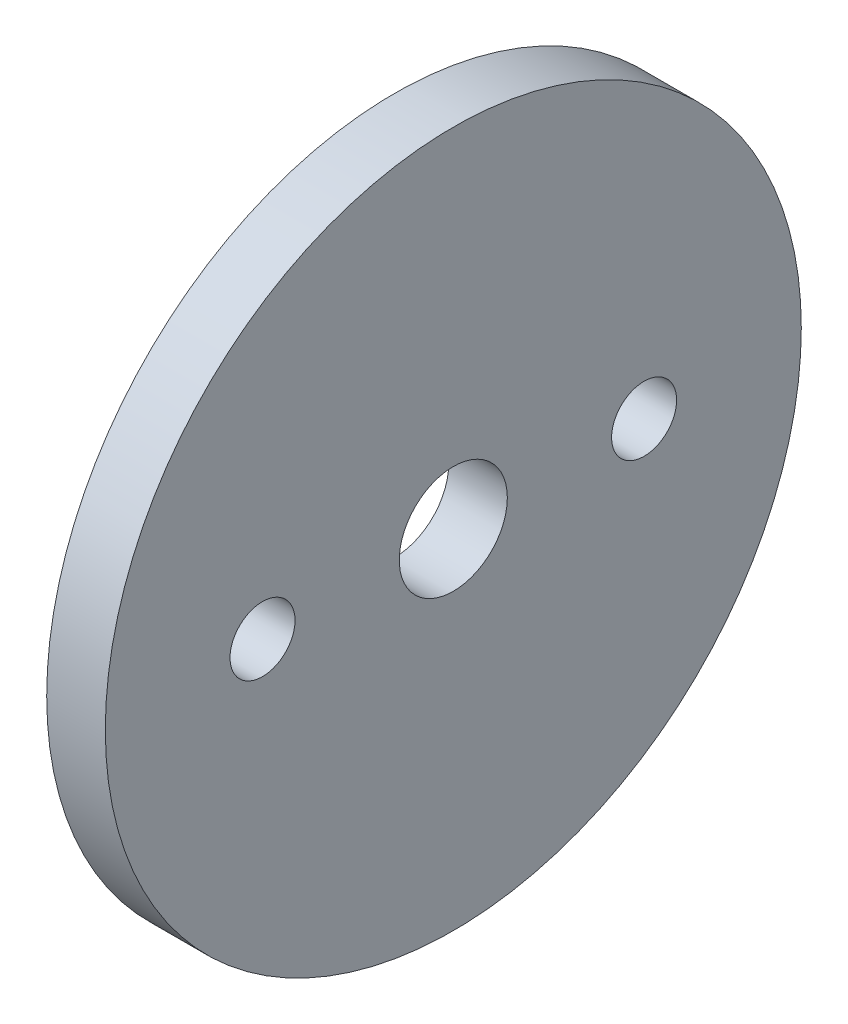
from build123d import *

# Parameters (mm, degrees)
SKETCH1_R                     = 14.478
BOSS_EXTRUDE1_DEPTH           = 2.4384
F_8_THREADED_ROD_CLEARANCE_D  = 4.4958
EJECTION_CHARGE_PASSTHROUGH_D = 2.7051


with BuildPart() as part:
    # Sketch1 → Boss-Extrude1 (new body)
    with BuildSketch(Plane(origin=(0, 0, 0), x_dir=(0, 0, -1), z_dir=(1, 0, 0))):
        Circle(SKETCH1_R)
    extrude(amount=BOSS_EXTRUDE1_DEPTH)

    # #8 Threaded Rod Clearance (through all)
    with Locations(Plane(origin=(2.4384, 0, 0), x_dir=(0, 0, -1), z_dir=(1, 0, 0))):
        with Locations((0, 0)):
            Hole(F_8_THREADED_ROD_CLEARANCE_D / 2)

    # Ejection Charge Passthrough (through all)
    with Locations(Plane(origin=(2.4384, 0, 0), x_dir=(0, 0, -1), z_dir=(1, 0, 0))):
        with Locations((-7.9375, 0), (7.9375, 0)):
            Hole(EJECTION_CHARGE_PASSTHROUGH_D / 2)


solid = part.part
